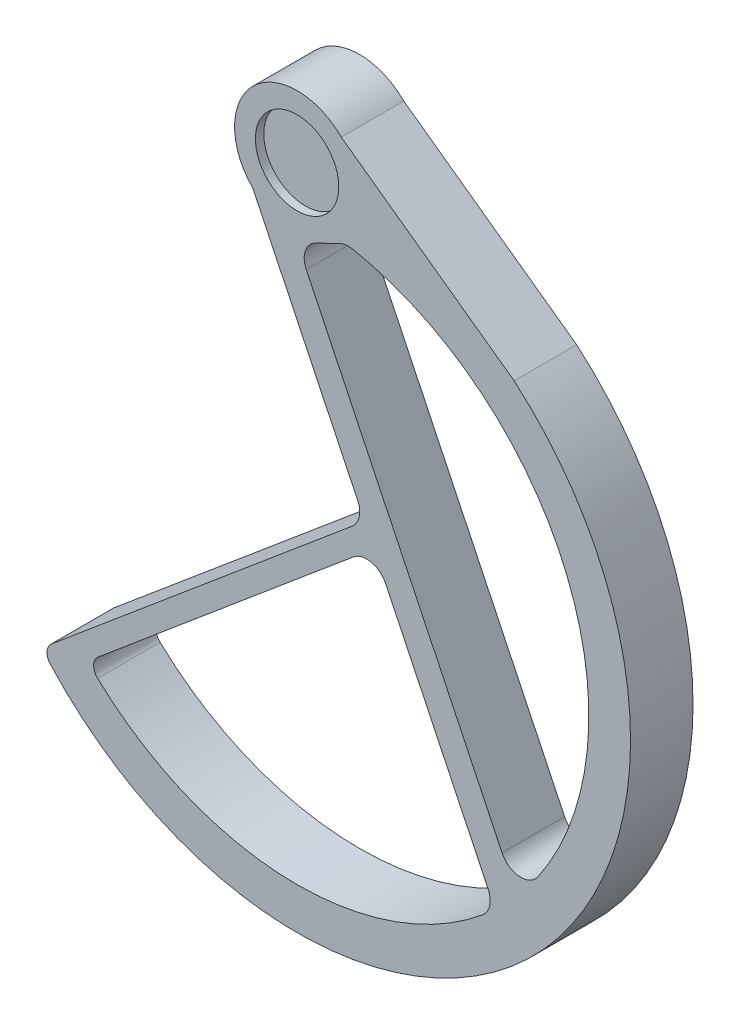
from build123d import *

# Parameters (mm, degrees)
EXTRUDE_1_DEPTH     = 15
CUT_EXTRUDE_START   = -15
CUT_EXTRUDE_1_DEPTH = 15
SKETCH_7_R          = 10
CUT_EXTRUDE_2_DEPTH = 2


with BuildPart() as part:
    # ｽｹｯﾁ4 → ﾎﾞｽ - 押し出し1 (new body)
    with BuildSketch(Plane.XY):
        with BuildLine():
            Line((-53.623111018, -124.995132678), (-58.940636287, -129.45706617))
            ThreePointArc((-58.940636287, -129.45706617), (-60.005384698, -131.552012131), (-59.233530865, -133.771635843))
            ThreePointArc((-59.233530865, -133.771635843), (57.362306223, -135.763481103), (52.076178918, -19.270504783))
            Line((52.076178918, -19.270504783), (10.606601718, 10.606601718))
            ThreePointArc((10.606601718, 10.606601718), (-10.606601718, 10.606601718), (-10.606601718, -10.606601718))
            Line((-10.606601718, -10.606601718), (14.536280154, -62.889638219))
            ThreePointArc((14.536280154, -62.889638219), (14.918089499, -66.109676181), (13.244185189, -68.886809092))
            Line((13.244185189, -68.886809092), (-53.623111018, -124.995132678))
        make_face()
        with BuildLine():
            Line((21.232400696, -76.813798404), (45.844843506, -127.993820346))
            ThreePointArc((45.844843506, -127.993820346), (46.221944165, -131.235480845), (44.518718993, -134.019289696))
            ThreePointArc((44.518718993, -134.019289696), (-2.231208213, -149.964431749), (-47.870174388, -131.072951785))
            ThreePointArc((-47.870174388, -131.072951785), (-48.817477846, -128.802229421), (-47.747678417, -126.586582094))
            Line((-47.747678417, -126.586582094), (13.511229465, -75.151532228))
            ThreePointArc((13.511229465, -75.151532228), (17.77869109, -74.092739753), (21.232400696, -76.813798404))
        make_face(mode=Mode.SUBTRACT)
    extrude(amount=EXTRUDE_1_DEPTH)

    # ｽｹｯﾁ6 → ｶｯﾄ - 押し出し1 (cut)
    with BuildSketch(Plane.XY.offset(15).offset(CUT_EXTRUDE_START)):
        with BuildLine():
            Line((49.189589797, -118.797265215), (2.201751786, -21.089020696))
            ThreePointArc((2.201751786, -21.089020696), (1.989274209, -17.268089629), (4.540836142, -14.416039025))
            Line((4.540836142, -14.416039025), (6.483415605, -13.48185369))
            Line((6.483415605, -13.48185369), (10.219658847, -11.685096486))
            ThreePointArc((10.219658847, -11.685096486), (11.747077013, -11.232198087), (13.339423466, -11.282754846))
            ThreePointArc((13.339423466, -11.282754846), (64.738421392, -53.37413296), (57.826055334, -119.448033215))
            ThreePointArc((57.826055334, -119.448033215), (53.319931874, -121.616182211), (49.189589797, -118.797265215))
        make_face()
    extrude(amount=CUT_EXTRUDE_1_DEPTH, mode=Mode.SUBTRACT)

    # ｽｹｯﾁ7 → ｶｯﾄ - 押し出し2 (cut)
    with BuildSketch(Plane.XY.offset(15)):
        Circle(SKETCH_7_R)
    extrude(amount=-CUT_EXTRUDE_2_DEPTH, mode=Mode.SUBTRACT)


solid = part.part
